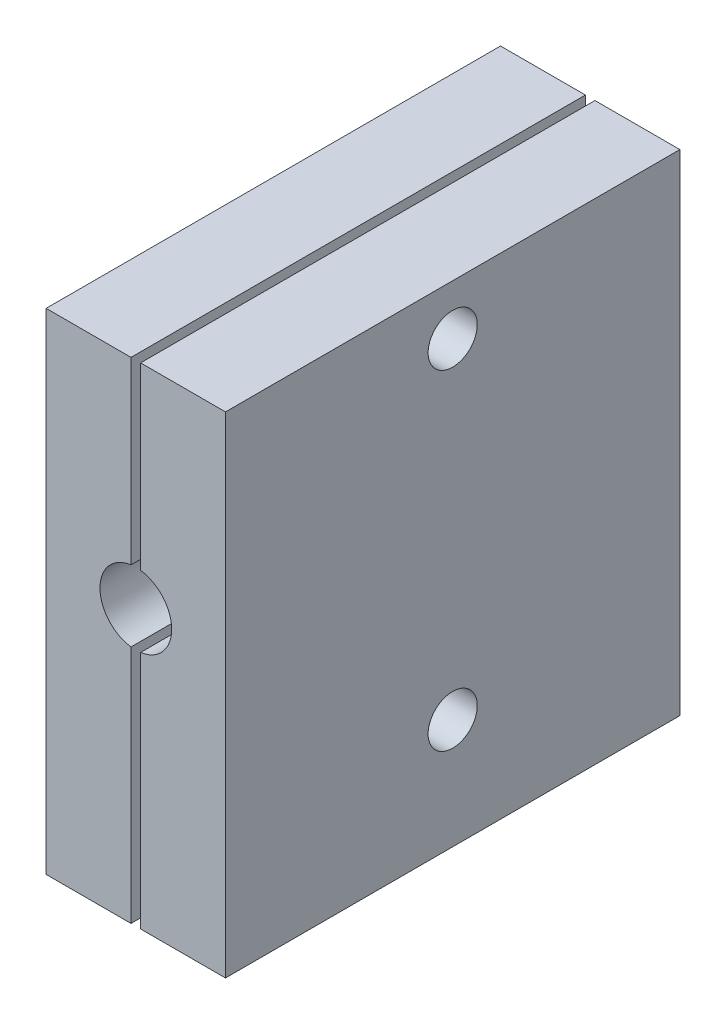
from build123d import *

# Parameters (mm, degrees)
SKETCH1_W               = 23.8125
SKETCH1_H               = 65.0875
SKETCH1_R               = 0.4699
SKETCH1_R_2             = 4.7625
BOSS_EXTRUDE1_DEPTH     = 30.1625
F_1_4_CLEARANCE_HOLE1_D = 6.5278
CUT_EXTRUDE1_DEPTH      = 46.941602708
CUT_EXTRUDE1_DEPTH_BACK = 46.941602708
SKETCH4_W               = 1.27
SKETCH4_H               = 65.0875


with BuildPart() as part:
    # Sketch1 → Boss-Extrude1 (new, symmetric)
    with BuildSketch(Plane.XY):
        Rectangle(SKETCH1_W, SKETCH1_H)
        with Locations((0, -13.49375)):
            Circle(SKETCH1_R, mode=Mode.SUBTRACT)
        with Locations((0, 21.43125)):
            Circle(SKETCH1_R, mode=Mode.SUBTRACT)
        with Locations(Location((0, 3.96875, 0), (0, 0, 180))):
            Circle(SKETCH1_R_2, mode=Mode.SUBTRACT)
    extrude(amount=BOSS_EXTRUDE1_DEPTH, both=True)

    # 1/4 Clearance Hole1 (through all)
    with Locations(Plane.ZY.offset(11.90625)):
        with Locations((0, 25.87625), (0, -17.93875)):
            Hole(F_1_4_CLEARANCE_HOLE1_D / 2)

    # Sketch4 → Cut-Extrude1 (cut, two sides: drawn at the far end of the back side and taken through both)
    with BuildSketch(Plane.XY.offset(-CUT_EXTRUDE1_DEPTH_BACK)):
        Rectangle(SKETCH4_W, SKETCH4_H)
    extrude(amount=CUT_EXTRUDE1_DEPTH + CUT_EXTRUDE1_DEPTH_BACK, mode=Mode.SUBTRACT)


with BuildPart() as cut_extrude1_piece_1:
    # of the separate pieces the step leaves, piece 1, a body of its own (cut_extrude1_pieces)
    add(part.part.solids().sort_by_distance((0.635, -32.54375, -30.1625))[0])


with BuildPart() as cut_extrude1_piece_2:
    # of the separate pieces the step leaves, piece 2, a body of its own (cut_extrude1_pieces)
    add(part.part.solids().sort_by_distance((-11.90625, -32.54375, 30.1625))[0])


solid = Compound([cut_extrude1_piece_1.part, cut_extrude1_piece_2.part])
